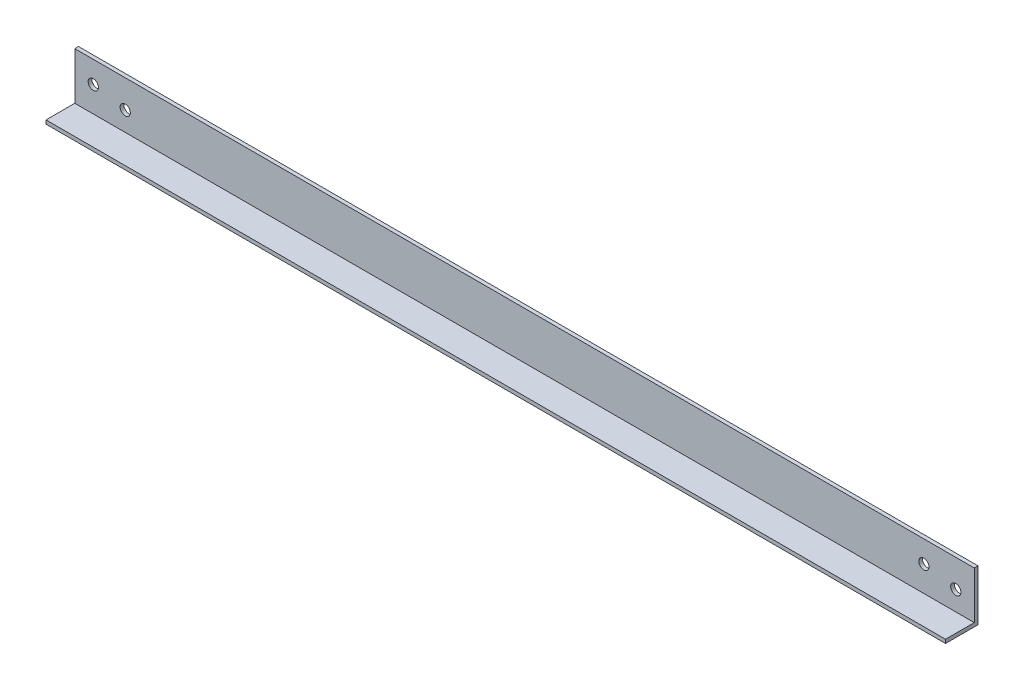
from build123d import *

# Parameters (mm, degrees)
SKETCH_1_W          = 1938
SKETCH_1_H          = 110
EXTRUDE_3_DEPTH     = 8
SKETCH_2_W          = 1938
SKETCH_2_H          = 8
EXTRUDE_4_DEPTH     = 62
SKETCH_4_R          = 11
CUT_EXTRUDE_1_DEPTH = 1943.381013087


with BuildPart() as part:
    # 草图1 → 拉伸3 (new body)
    with BuildSketch(Plane.XY):
        with Locations((969, 55)):
            Rectangle(SKETCH_1_W, SKETCH_1_H)
    extrude(amount=EXTRUDE_3_DEPTH)

    # 草图2 → 拉伸4 (add)
    with BuildSketch(Plane.XY.offset(8)):
        with Locations((969, 4)):
            Rectangle(SKETCH_2_W, SKETCH_2_H)
    extrude(amount=EXTRUDE_4_DEPTH)

    # 草图4 → 切除-拉伸1 (cut, through all)
    with BuildSketch(Plane(origin=(0, 0, 0), x_dir=(-1, 0, 0), z_dir=(0, 0, -1))):
        with Locations((-1898.156876116, 50)):
            Circle(SKETCH_4_R)
        with Locations((-1829.360689526, 62.920321616)):
            Circle(SKETCH_4_R)
        with Locations((-108.684226659, 50)):
            Circle(SKETCH_4_R)
        with Locations((-39.888040069, 62.920321616)):
            Circle(SKETCH_4_R)
    extrude(amount=-CUT_EXTRUDE_1_DEPTH, mode=Mode.SUBTRACT)


solid = part.part
